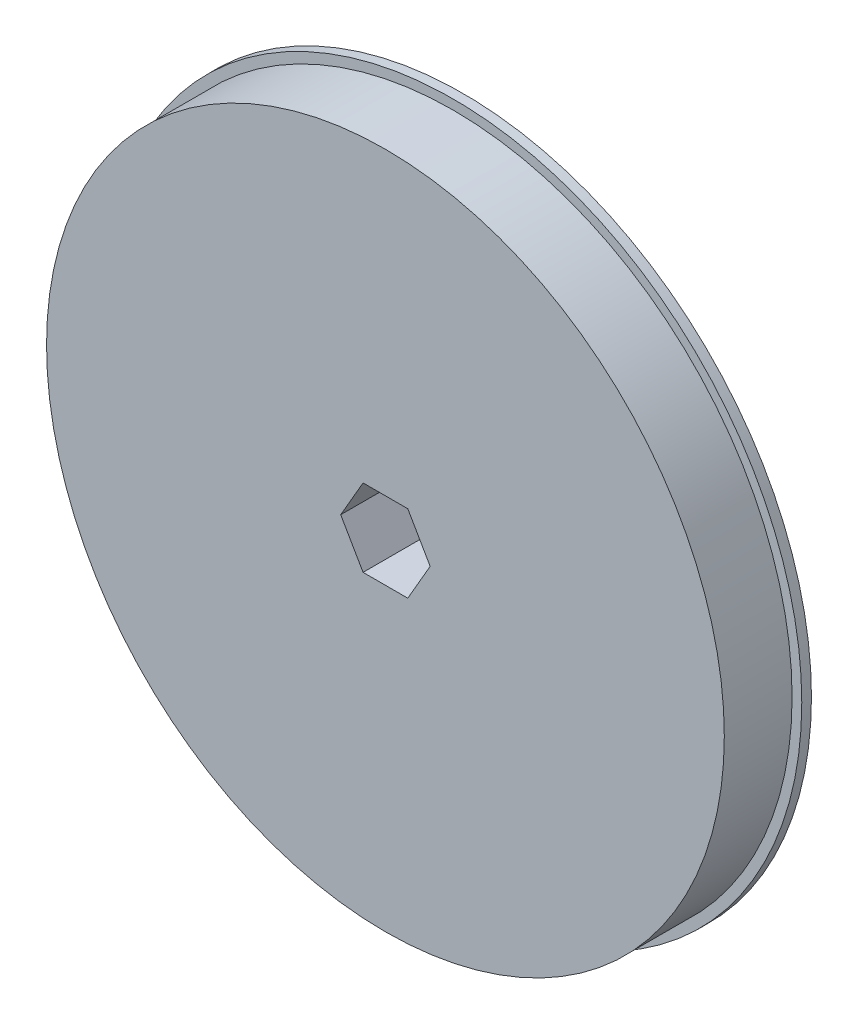
from build123d import *

# Parameters (mm, degrees)
SKETCH1_R           = 57.15
BOSS_EXTRUDE1_DEPTH = 12.7
CUT_EXTRUDE1_START  = -11.1125
SKETCH2_R           = 57.15
SKETCH2_R_2         = 55.5625
CUT_EXTRUDE1_DEPTH  = 11.1125
SKETCH3_R           = 50.8
CUT_EXTRUDE2_DEPTH  = 9.525
SKETCH4_R           = 12.7
BOSS_EXTRUDE2_DEPTH = 6.35
CUT_EXTRUDE4_DEPTH  = 12.7
CHAMFER1_SIZE       = 0.79375


with BuildPart() as part:
    # Sketch1 → Boss-Extrude1 (new body)
    with BuildSketch(Plane.XY):
        Circle(SKETCH1_R)
    extrude(amount=BOSS_EXTRUDE1_DEPTH)

    # Sketch2 → Cut-Extrude1 (cut)
    with BuildSketch(Plane.XY.offset(12.7).offset(CUT_EXTRUDE1_START)):
        Circle(SKETCH2_R)
        Circle(SKETCH2_R_2, mode=Mode.SUBTRACT)
    extrude(amount=CUT_EXTRUDE1_DEPTH, mode=Mode.SUBTRACT)

    # Sketch3 → Cut-Extrude2 (cut)
    with BuildSketch(Plane(origin=(0, 0, 0), x_dir=(-1, 0, 0), z_dir=(0, 0, -1))):
        Circle(SKETCH3_R)
    extrude(amount=-CUT_EXTRUDE2_DEPTH, mode=Mode.SUBTRACT)

    # Sketch4 → Boss-Extrude2 (add)
    with BuildSketch(Plane(origin=(0, 0, 9.525), x_dir=(-1, 0, 0), z_dir=(0, 0, -1))):
        Circle(SKETCH4_R)
    extrude(amount=BOSS_EXTRUDE2_DEPTH)

    # Sketch6 → Cut-Extrude4 (cut)
    with BuildSketch(Plane(origin=(0, 0, 3.175), x_dir=(-1, 0, 0), z_dir=(0, 0, -1))):
        Polygon((7.332348419, 0), (3.666174209, 6.35), (-3.666174209, 6.35), (-7.332348419, 0), (-3.666174209, -6.35), (3.666174209, -6.35), align=None)
    extrude(amount=-CUT_EXTRUDE4_DEPTH, mode=Mode.SUBTRACT)

    # Chamfer1
    chamfer1_edges = [part.edges().sort_by_distance(p)[0] for p in [
        (12.7, 0, 3.175),
    ]]
    chamfer(chamfer1_edges, length=CHAMFER1_SIZE)


solid = part.part
